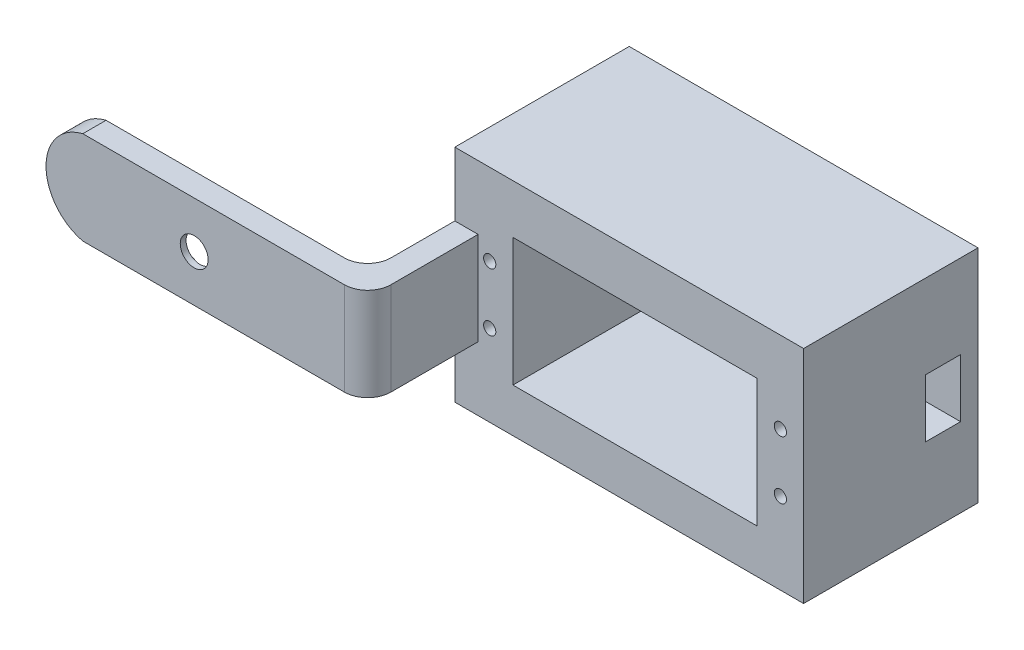
from build123d import *

# Parameters (mm, degrees)
BOSS_EXTRUDE1_DEPTH  = 4
CUT_EXTRUDE1_DEPTH   = 3
SKETCH5_W            = 49
SKETCH5_H            = 16
BOSS_EXTRUDE2_DEPTH  = 4
BOSS_EXTRUDE15_DEPTH = 30
SKETCH20_R           = 2.4
CUT_EXTRUDE26_DEPTH  = 1
FILLET8_R            = 4
FILLET12_R           = 4
CUT_EXTRUDE_8_DEPTH  = 28
SKETCH_6_R           = 1.05
CUT_EXTRUDE_9_DEPTH  = 20
SKETCH_8_W           = 6
SKETCH_8_H           = 10
CUT_EXTRUDE_10_DEPTH = 8


with BuildPart() as part:
    # Sketch2 → Boss-Extrude1 (new body)
    with BuildSketch(Plane.XY):
        with BuildLine():
            Line((23.733047461, 11.63962887), (23.733047461, -4.36037113))
            Line((23.733047461, -4.36037113), (-21.266952539, -4.36037113))
            ThreePointArc((-21.266952539, -4.36037113), (-27.597931628, 3.63962887), (-21.266952539, 11.63962887))
            Line((-21.266952539, 11.63962887), (23.733047461, 11.63962887))
        make_face()
    extrude(amount=BOSS_EXTRUDE1_DEPTH)

    # Sketch1 → Cut-Extrude1 (cut)
    with BuildSketch(Plane.XY):
        with BuildLine():
            Line((-6.25004119, 8.63962887), (-20.04279291, 6.23962887))
            ThreePointArc((-20.04279291, 6.23962887), (-22.105421524, 3.63962887), (-20.04279291, 1.03962887))
            Line((-20.04279291, 1.03962887), (-6.25004119, -1.36037113))
            ThreePointArc((-6.25004119, -1.36037113), (-2.105421524, -2.86037113), (2.039198142, -1.36037113))
            Line((2.039198142, -1.36037113), (15.831949862, 1.03962887))
            ThreePointArc((15.831949862, 1.03962887), (17.894578476, 3.63962887), (15.831949862, 6.23962887))
            Line((15.831949862, 6.23962887), (2.039198142, 8.63962887))
            ThreePointArc((2.039198142, 8.63962887), (-2.105421524, 10.13962887), (-6.25004119, 8.63962887))
        make_face()
    extrude(amount=CUT_EXTRUDE1_DEPTH, mode=Mode.SUBTRACT)

    # Sketch5 → Boss-Extrude2 (add)
    with BuildSketch(Plane(origin=(23.733047461, 0, 0), x_dir=(0, 0, -1), z_dir=(1, 0, 0))):
        with Locations((20.5, 3.63962887)):
            Rectangle(SKETCH5_W, SKETCH5_H)
    extrude(amount=BOSS_EXTRUDE2_DEPTH)

    # Sketch6 → Boss-Extrude15 (add)
    with BuildSketch(Plane(origin=(0, 0, -45), x_dir=(-1, 0, 0), z_dir=(0, 0, -1))):
        Polygon((-30.946192459, -15.36037113), (-83.733047461, -15.36037113), (-83.733047461, 22.63962887), (-23.733047461, 22.63962887), (-23.733047461, -15.36037113), align=None)
    extrude(amount=-BOSS_EXTRUDE15_DEPTH)

    # Sketch20 → Cut-Extrude26 (cut)
    with BuildSketch(Plane(origin=(0, 0, 3), x_dir=(-1, 0, 0), z_dir=(0, 0, -1))):
        with Locations((2.105421524, 3.63962887)):
            Circle(SKETCH20_R)
    extrude(amount=-CUT_EXTRUDE26_DEPTH, mode=Mode.SUBTRACT)

    # Fillet8
    fillet8_edges = [part.edges().sort_by_distance(p)[0] for p in [
        (23.733047461, 3.63962887, 0),
    ]]
    fillet(fillet8_edges, radius=FILLET8_R)

    # Fillet12
    fillet12_edges = [part.edges().sort_by_distance(p)[0] for p in [
        (27.733047461, 3.63962887, 4),
    ]]
    fillet(fillet12_edges, radius=FILLET12_R)

    # 草圖5 → 除料-伸長8 (cut)
    with BuildSketch(Plane.XY.offset(-15)):
        Polygon((75.733047461, -7.806095257), (75.733047461, 14.193904743), (33.733047461, 14.193904743), (33.733047461, 3.193904743), (33.733047461, -7.806095257), align=None)
    extrude(amount=-CUT_EXTRUDE_8_DEPTH, mode=Mode.SUBTRACT)

    # 草圖6 → 除料-伸長9 (cut)
    with BuildSketch(Plane.XY.offset(-15)):
        with Locations((29.733047461, 8.63962887)):
            Circle(SKETCH_6_R)
        with Locations((29.733047461, -1.36037113)):
            Circle(SKETCH_6_R)
        with Locations((79.733047461, 8.63962887)):
            Circle(SKETCH_6_R)
        with Locations((79.733047461, -1.36037113)):
            Circle(SKETCH_6_R)
    extrude(amount=-CUT_EXTRUDE_9_DEPTH, mode=Mode.SUBTRACT)

    # 草圖8 → 除料-伸長10 (cut)
    with BuildSketch(Plane(origin=(83.733047461, 0, 0), x_dir=(0, 0, -1), z_dir=(1, 0, 0))):
        with Locations((39, 3.238584995)):
            Rectangle(SKETCH_8_W, SKETCH_8_H)
    extrude(amount=-CUT_EXTRUDE_10_DEPTH, mode=Mode.SUBTRACT)


solid = part.part
